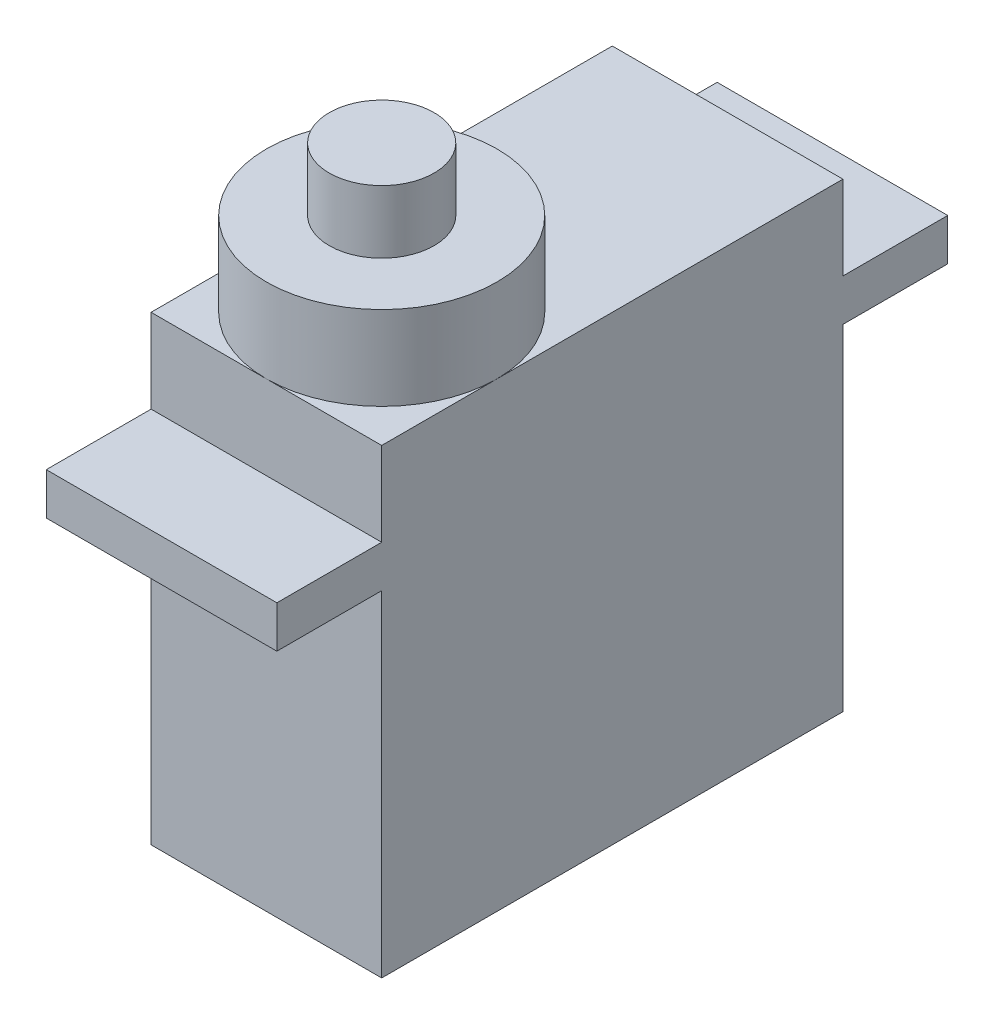
from build123d import *

# Parameters (mm, degrees)
SKETCH1_W           = 11
SKETCH1_H           = 22
BOSS_EXTRUDE1_DEPTH = 22
SKETCH3_W           = 11
SKETCH3_H           = 2
BOSS_EXTRUDE3_DEPTH = 5
SKETCH2_R           = 5.5
BOSS_EXTRUDE4_DEPTH = 4
SKETCH4_R           = 2.5
BOSS_EXTRUDE5_DEPTH = 3


with BuildPart() as part:
    # Sketch1 → Boss-Extrude1 (new body)
    with BuildSketch(Plane(origin=(0, 0, 0), x_dir=(1, 0, 0), z_dir=(0, 1, 0))):
        Rectangle(SKETCH1_W, SKETCH1_H)
    extrude(amount=BOSS_EXTRUDE1_DEPTH)

    # Sketch3 → Boss-Extrude3 (add)
    with BuildSketch(Plane(origin=(0, 0, -11), x_dir=(-1, 0, 0), z_dir=(0, 0, -1))):
        with Locations((0, 17)):
            Rectangle(SKETCH3_W, SKETCH3_H)
    boss_extrude3 = extrude(amount=BOSS_EXTRUDE3_DEPTH)

    # Mirror1: Boss-Extrude3 across plane
    add(boss_extrude3.mirror(Plane.XY))

    # Sketch2 → Boss-Extrude4 (add)
    with BuildSketch(Plane(origin=(0, 22, 0), x_dir=(1, 0, 0), z_dir=(0, 1, 0))):
        with Locations(Location((0, -5.5, 0), (0, 0, 270))):
            Circle(SKETCH2_R)
    extrude(amount=BOSS_EXTRUDE4_DEPTH)

    # Sketch4 → Boss-Extrude5 (add)
    with BuildSketch(Plane(origin=(0, 26, 0), x_dir=(1, 0, 0), z_dir=(0, 1, 0))):
        with Locations(Location((0, -5.5, 0), (0, 0, 270))):
            Circle(SKETCH4_R)
    extrude(amount=BOSS_EXTRUDE5_DEPTH)


solid = part.part
